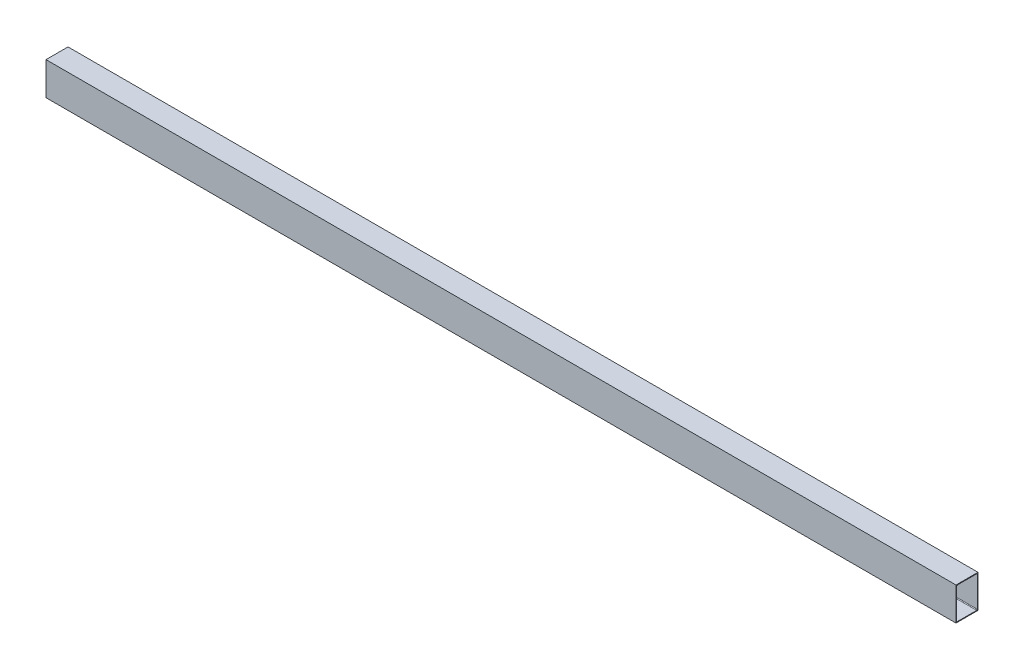
from build123d import *

# Parameters (mm, degrees)
SKETCH1_W           = 101.6
SKETCH1_H           = 152.4
BOSS_EXTRUDE1_DEPTH = 4200


with BuildPart() as part:
    # Sketch1 → Boss-Extrude1 (new body)
    with BuildSketch(Plane(origin=(0, 0, 0), x_dir=(0, 0, -1), z_dir=(1, 0, 0))):
        with Locations((-50.8, 76.2)):
            Rectangle(SKETCH1_W, SKETCH1_H)
        with BuildLine():
            Line((-98.425, 6.35), (-98.425, 146.05))
            ThreePointArc((-98.425, 146.05), (-97.49506403, 148.29506403), (-95.25, 149.225))
            Line((-95.25, 149.225), (-6.35, 149.225))
            ThreePointArc((-6.35, 149.225), (-4.10493597, 148.29506403), (-3.175, 146.05))
            Line((-3.175, 146.05), (-3.175, 6.35))
            ThreePointArc((-3.175, 6.35), (-4.10493597, 4.10493597), (-6.35, 3.175))
            Line((-6.35, 3.175), (-95.25, 3.175))
            ThreePointArc((-95.25, 3.175), (-97.49506403, 4.10493597), (-98.425, 6.35))
        make_face(mode=Mode.SUBTRACT)
    extrude(amount=BOSS_EXTRUDE1_DEPTH)


solid = part.part
